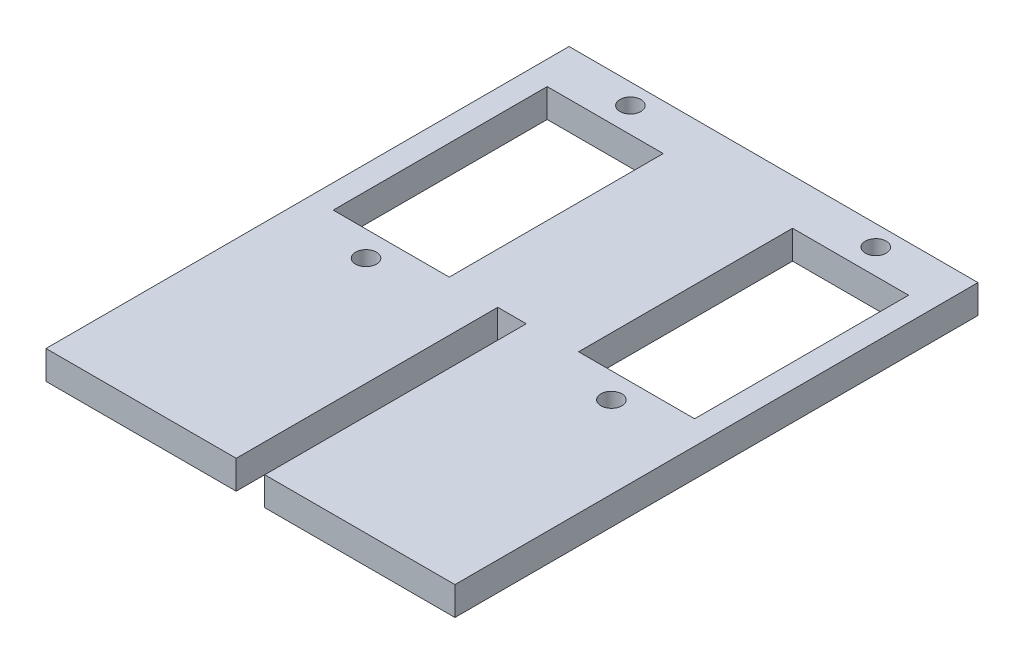
from build123d import *

# Parameters (mm, degrees)
SKETCH1_W           = 43
SKETCH1_H           = 55
BOSS_EXTRUDE1_DEPTH = 3
SKETCH2_W           = 3
SKETCH2_H           = 27.5
CUT_EXTRUDE1_DEPTH  = 10
SKETCH3_R           = 1.1
SKETCH3_W           = 12.2
SKETCH3_H           = 22.5
CUT_EXTRUDE2_DEPTH  = 10


with BuildPart() as part:
    # Sketch1 → Boss-Extrude1 (new body)
    with BuildSketch(Plane(origin=(0, 0, 0), x_dir=(1, 0, 0), z_dir=(0, 1, 0))):
        Rectangle(SKETCH1_W, SKETCH1_H)
    extrude(amount=BOSS_EXTRUDE1_DEPTH)

    # Sketch2 → Cut-Extrude1 (cut)
    with BuildSketch(Plane(origin=(0, 3, 0), x_dir=(1, 0, 0), z_dir=(0, 1, 0))):
        with Locations((0, -13.75)):
            Rectangle(SKETCH2_W, SKETCH2_H)
    extrude(amount=-CUT_EXTRUDE1_DEPTH, mode=Mode.SUBTRACT)

    # Sketch3 → Cut-Extrude2 (cut)
    with BuildSketch(Plane.XZ):
        with Locations(Location((12.9, -25.35, 0), (0, 0, 270))):
            Circle(SKETCH3_R)
        with Locations(Location((12.9, 2.45, 0), (0, 0, 270))):
            Circle(SKETCH3_R)
        with Locations(Location((-12.9, -25.35, 0), (0, 0, 270))):
            Circle(SKETCH3_R)
        with Locations(Location((-12.9, 2.45, 0), (0, 0, 270))):
            Circle(SKETCH3_R)
        with Locations((12.9, -11.45)):
            Rectangle(SKETCH3_W, SKETCH3_H)
        with Locations((-12.9, -11.45)):
            Rectangle(SKETCH3_W, SKETCH3_H)
    extrude(amount=-CUT_EXTRUDE2_DEPTH, mode=Mode.SUBTRACT)


solid = part.part
